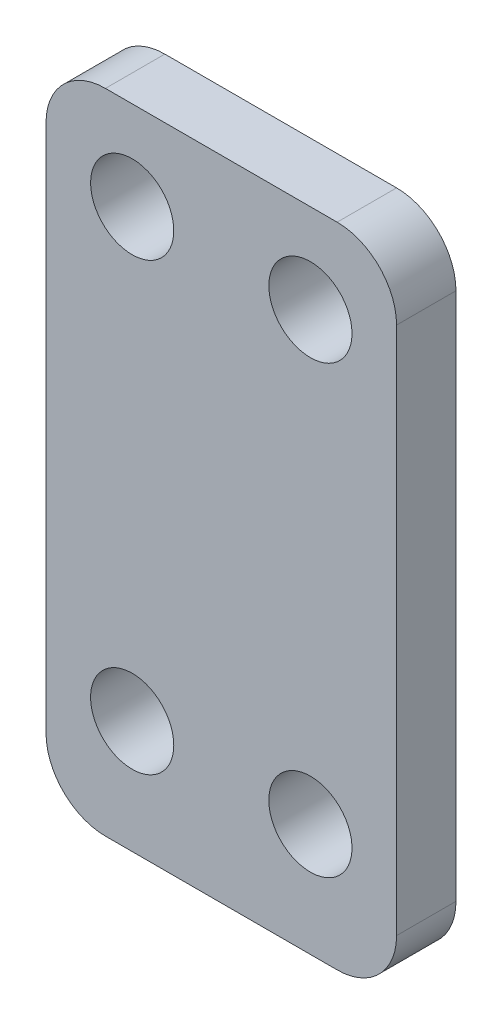
from build123d import *

# Parameters (mm, degrees)
SKETCH_1_W      = 11.8
SKETCH_1_H      = 21.8
SKETCH_1_R      = 1.4
EXTRUDE_1_DEPTH = 2
FILLET_1_R      = 2


with BuildPart() as part:
    # 草图1 → 凸台-拉伸1 (new body)
    with BuildSketch(Plane.XY):
        Rectangle(SKETCH_1_W, SKETCH_1_H)
        with Locations((-3, -7.1)):
            Circle(SKETCH_1_R, mode=Mode.SUBTRACT)
        with Locations(Location((-3, 7.9, 0), (0, 0, 180))):
            Circle(SKETCH_1_R, mode=Mode.SUBTRACT)
        with Locations((3, 7.9)):
            Circle(SKETCH_1_R, mode=Mode.SUBTRACT)
        with Locations(Location((3, -7.1, 0), (0, 0, 180))):
            Circle(SKETCH_1_R, mode=Mode.SUBTRACT)
    extrude(amount=EXTRUDE_1_DEPTH)

    # 圆角1
    fillet_1_edges = [part.edges().sort_by_distance(p)[0] for p in [
        (5.9, -10.9, 1),
        (-5.9, -10.9, 1),
        (-5.9, 10.9, 1),
        (5.9, 10.9, 1),
    ]]
    fillet(fillet_1_edges, radius=FILLET_1_R)


solid = part.part
